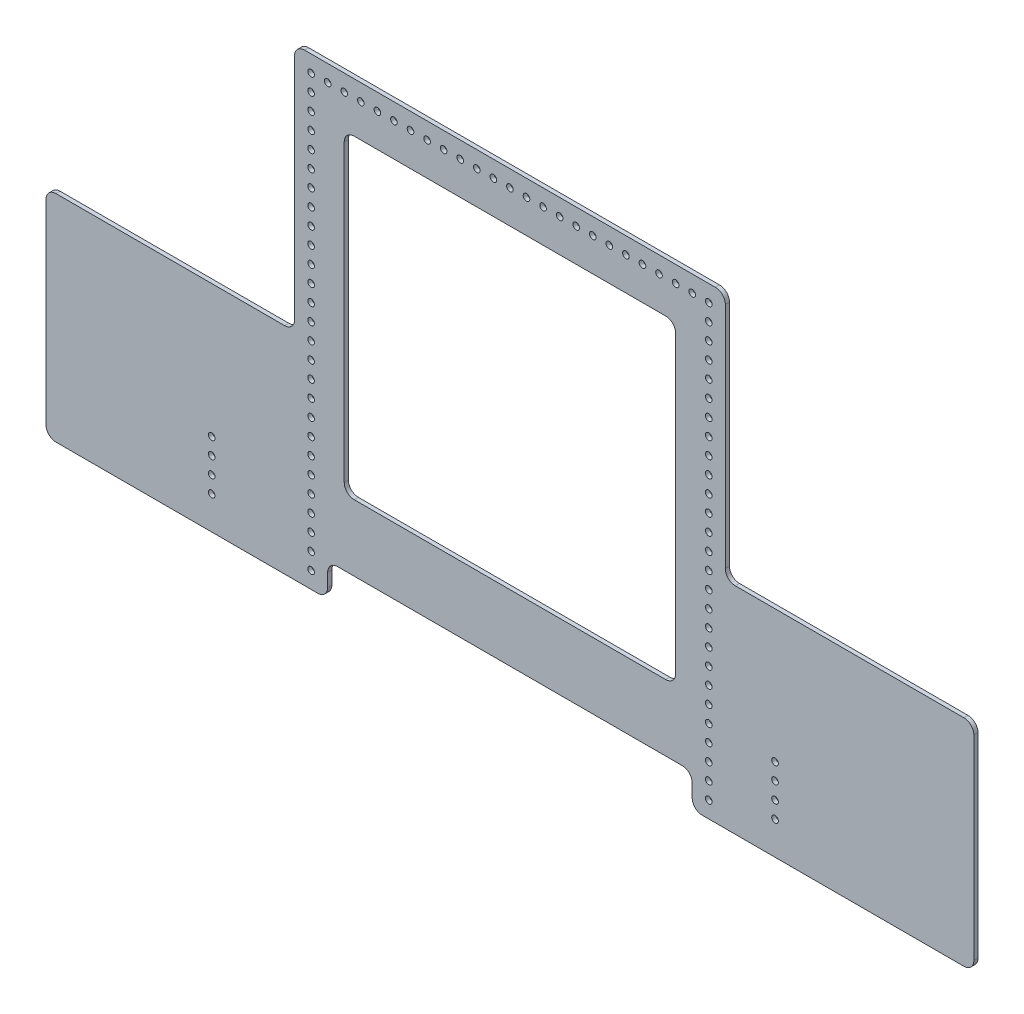
from build123d import *

# Parameters (mm, degrees)
SKETCH1_R           = 2.54
SKETCH1_W           = 254
SKETCH1_H           = 241.3
BOSS_EXTRUDE1_DEPTH = 3.175
FILLET1_R           = 7.62


with BuildPart() as part:
    # Sketch1 → Boss-Extrude1 (new body)
    with BuildSketch(Plane.XY):
        Polygon((392.015739824, -380.530659381), (607.915739824, -380.530659381), (607.915739824, -215.553323478), (417.415739824, -215.553323478), (417.415739824, -25.053323478), (87.215739824, -25.053323478), (87.215739824, -215.553323478), (-103.284260176, -215.553323478), (-103.284260176, -380.530659381), (112.615739824, -380.530659381), (112.615739824, -355.253323478), (392.015739824, -355.253323478), align=None)
        with Locations((99.915739824, -37.753323478)):
            Circle(SKETCH1_R, mode=Mode.SUBTRACT)
        with Locations((112.615739824, -37.753323478)):
            Circle(SKETCH1_R, mode=Mode.SUBTRACT)
        with Locations((125.315739824, -37.753323478)):
            Circle(SKETCH1_R, mode=Mode.SUBTRACT)
        with Locations((138.015739824, -37.753323478)):
            Circle(SKETCH1_R, mode=Mode.SUBTRACT)
        with Locations((150.715739824, -37.753323478)):
            Circle(SKETCH1_R, mode=Mode.SUBTRACT)
        with Locations((163.415739824, -37.753323478)):
            Circle(SKETCH1_R, mode=Mode.SUBTRACT)
        with Locations((176.115739824, -37.753323478)):
            Circle(SKETCH1_R, mode=Mode.SUBTRACT)
        with Locations((188.815739824, -37.753323478)):
            Circle(SKETCH1_R, mode=Mode.SUBTRACT)
        with Locations((201.515739824, -37.753323478)):
            Circle(SKETCH1_R, mode=Mode.SUBTRACT)
        with Locations((214.215739824, -37.753323478)):
            Circle(SKETCH1_R, mode=Mode.SUBTRACT)
        with Locations((226.915739824, -37.753323478)):
            Circle(SKETCH1_R, mode=Mode.SUBTRACT)
        with Locations((239.615739824, -37.753323478)):
            Circle(SKETCH1_R, mode=Mode.SUBTRACT)
        with Locations((252.315739824, -37.753323478)):
            Circle(SKETCH1_R, mode=Mode.SUBTRACT)
        with Locations((265.015739824, -37.753323478)):
            Circle(SKETCH1_R, mode=Mode.SUBTRACT)
        with Locations((277.715739824, -37.753323478)):
            Circle(SKETCH1_R, mode=Mode.SUBTRACT)
        with Locations((290.415739824, -37.753323478)):
            Circle(SKETCH1_R, mode=Mode.SUBTRACT)
        with Locations((303.115739824, -37.753323478)):
            Circle(SKETCH1_R, mode=Mode.SUBTRACT)
        with Locations((315.815739824, -37.753323478)):
            Circle(SKETCH1_R, mode=Mode.SUBTRACT)
        with Locations((328.515739824, -37.753323478)):
            Circle(SKETCH1_R, mode=Mode.SUBTRACT)
        with Locations((341.215739824, -37.753323478)):
            Circle(SKETCH1_R, mode=Mode.SUBTRACT)
        with Locations((353.915739824, -37.753323478)):
            Circle(SKETCH1_R, mode=Mode.SUBTRACT)
        with Locations((366.615739824, -37.753323478)):
            Circle(SKETCH1_R, mode=Mode.SUBTRACT)
        with Locations((379.315739824, -37.753323478)):
            Circle(SKETCH1_R, mode=Mode.SUBTRACT)
        with Locations((392.015739824, -37.753323478)):
            Circle(SKETCH1_R, mode=Mode.SUBTRACT)
        with Locations((404.715739824, -37.753323478)):
            Circle(SKETCH1_R, mode=Mode.SUBTRACT)
        with Locations((99.915739824, -50.453323478)):
            Circle(SKETCH1_R, mode=Mode.SUBTRACT)
        with Locations((99.915739824, -63.153323478)):
            Circle(SKETCH1_R, mode=Mode.SUBTRACT)
        with Locations((99.915739824, -75.853323478)):
            Circle(SKETCH1_R, mode=Mode.SUBTRACT)
        with Locations((99.915739824, -88.553323478)):
            Circle(SKETCH1_R, mode=Mode.SUBTRACT)
        with Locations((99.915739824, -101.253323478)):
            Circle(SKETCH1_R, mode=Mode.SUBTRACT)
        with Locations((99.915739824, -113.953323478)):
            Circle(SKETCH1_R, mode=Mode.SUBTRACT)
        with Locations((99.915739824, -126.653323478)):
            Circle(SKETCH1_R, mode=Mode.SUBTRACT)
        with Locations((99.915739824, -139.353323478)):
            Circle(SKETCH1_R, mode=Mode.SUBTRACT)
        with Locations((99.915739824, -152.053323478)):
            Circle(SKETCH1_R, mode=Mode.SUBTRACT)
        with Locations((99.915739824, -164.753323478)):
            Circle(SKETCH1_R, mode=Mode.SUBTRACT)
        with Locations((99.915739824, -177.453323478)):
            Circle(SKETCH1_R, mode=Mode.SUBTRACT)
        with Locations((99.915739824, -190.153323478)):
            Circle(SKETCH1_R, mode=Mode.SUBTRACT)
        with Locations((99.915739824, -202.853323478)):
            Circle(SKETCH1_R, mode=Mode.SUBTRACT)
        with Locations((99.915739824, -215.553323478)):
            Circle(SKETCH1_R, mode=Mode.SUBTRACT)
        with Locations((99.915739824, -228.253323478)):
            Circle(SKETCH1_R, mode=Mode.SUBTRACT)
        with Locations((99.915739824, -240.953323478)):
            Circle(SKETCH1_R, mode=Mode.SUBTRACT)
        with Locations((99.915739824, -253.653323478)):
            Circle(SKETCH1_R, mode=Mode.SUBTRACT)
        with Locations((99.915739824, -266.353323478)):
            Circle(SKETCH1_R, mode=Mode.SUBTRACT)
        with Locations((99.915739824, -279.053323478)):
            Circle(SKETCH1_R, mode=Mode.SUBTRACT)
        with Locations((99.915739824, -291.753323478)):
            Circle(SKETCH1_R, mode=Mode.SUBTRACT)
        with Locations((99.915739824, -304.453323478)):
            Circle(SKETCH1_R, mode=Mode.SUBTRACT)
        with Locations((99.915739824, -317.153323478)):
            Circle(SKETCH1_R, mode=Mode.SUBTRACT)
        with Locations((99.915739824, -329.853323478)):
            Circle(SKETCH1_R, mode=Mode.SUBTRACT)
        with Locations((99.915739824, -342.553323478)):
            Circle(SKETCH1_R, mode=Mode.SUBTRACT)
        with Locations((99.915739824, -355.253323478)):
            Circle(SKETCH1_R, mode=Mode.SUBTRACT)
        with Locations((99.915739824, -367.953323478)):
            Circle(SKETCH1_R, mode=Mode.SUBTRACT)
        with Locations((404.715739824, -50.453323478)):
            Circle(SKETCH1_R, mode=Mode.SUBTRACT)
        with Locations((404.715739824, -63.153323478)):
            Circle(SKETCH1_R, mode=Mode.SUBTRACT)
        with Locations((404.715739824, -75.853323478)):
            Circle(SKETCH1_R, mode=Mode.SUBTRACT)
        with Locations((404.715739824, -88.553323478)):
            Circle(SKETCH1_R, mode=Mode.SUBTRACT)
        with Locations((404.715739824, -101.253323478)):
            Circle(SKETCH1_R, mode=Mode.SUBTRACT)
        with Locations((404.715739824, -113.953323478)):
            Circle(SKETCH1_R, mode=Mode.SUBTRACT)
        with Locations((404.715739824, -126.653323478)):
            Circle(SKETCH1_R, mode=Mode.SUBTRACT)
        with Locations((404.715739824, -139.353323478)):
            Circle(SKETCH1_R, mode=Mode.SUBTRACT)
        with Locations((404.715739824, -152.053323478)):
            Circle(SKETCH1_R, mode=Mode.SUBTRACT)
        with Locations((404.715739824, -164.753323478)):
            Circle(SKETCH1_R, mode=Mode.SUBTRACT)
        with Locations((404.715739824, -177.453323478)):
            Circle(SKETCH1_R, mode=Mode.SUBTRACT)
        with Locations((404.715739824, -190.153323478)):
            Circle(SKETCH1_R, mode=Mode.SUBTRACT)
        with Locations((404.715739824, -202.853323478)):
            Circle(SKETCH1_R, mode=Mode.SUBTRACT)
        with Locations((404.715739824, -215.553323478)):
            Circle(SKETCH1_R, mode=Mode.SUBTRACT)
        with Locations((404.715739824, -228.253323478)):
            Circle(SKETCH1_R, mode=Mode.SUBTRACT)
        with Locations((404.715739824, -240.953323478)):
            Circle(SKETCH1_R, mode=Mode.SUBTRACT)
        with Locations((404.715739824, -253.653323478)):
            Circle(SKETCH1_R, mode=Mode.SUBTRACT)
        with Locations((404.715739824, -266.353323478)):
            Circle(SKETCH1_R, mode=Mode.SUBTRACT)
        with Locations((404.715739824, -279.053323478)):
            Circle(SKETCH1_R, mode=Mode.SUBTRACT)
        with Locations((404.715739824, -291.753323478)):
            Circle(SKETCH1_R, mode=Mode.SUBTRACT)
        with Locations((404.715739824, -304.453323478)):
            Circle(SKETCH1_R, mode=Mode.SUBTRACT)
        with Locations((404.715739824, -317.153323478)):
            Circle(SKETCH1_R, mode=Mode.SUBTRACT)
        with Locations((404.715739824, -329.853323478)):
            Circle(SKETCH1_R, mode=Mode.SUBTRACT)
        with Locations((404.715739824, -342.553323478)):
            Circle(SKETCH1_R, mode=Mode.SUBTRACT)
        with Locations((404.715739824, -355.253323478)):
            Circle(SKETCH1_R, mode=Mode.SUBTRACT)
        with Locations((404.715739824, -367.953323478)):
            Circle(SKETCH1_R, mode=Mode.SUBTRACT)
        with Locations((23.715739824, -317.153323478)):
            Circle(SKETCH1_R, mode=Mode.SUBTRACT)
        with Locations((455.515739824, -317.153323478)):
            Circle(SKETCH1_R, mode=Mode.SUBTRACT)
        with Locations((455.515739824, -329.853323478)):
            Circle(SKETCH1_R, mode=Mode.SUBTRACT)
        with Locations((455.515739824, -342.553323478)):
            Circle(SKETCH1_R, mode=Mode.SUBTRACT)
        with Locations((455.515739824, -355.253323478)):
            Circle(SKETCH1_R, mode=Mode.SUBTRACT)
        with Locations((23.715739824, -329.853323478)):
            Circle(SKETCH1_R, mode=Mode.SUBTRACT)
        with Locations((23.715739824, -342.553323478)):
            Circle(SKETCH1_R, mode=Mode.SUBTRACT)
        with Locations((23.715739824, -355.253323478)):
            Circle(SKETCH1_R, mode=Mode.SUBTRACT)
        with Locations((252.315739824, -183.803323478)):
            Rectangle(SKETCH1_W, SKETCH1_H, mode=Mode.SUBTRACT)
    extrude(amount=BOSS_EXTRUDE1_DEPTH)

    # Fillet1
    fillet1_edges = [part.edges().sort_by_distance(p)[0] for p in [
        (607.915739824, -380.530659381, 1.5875),
        (392.015739824, -380.530659381, 1.5875),
        (392.015739824, -355.253323478, 1.5875),
        (112.615739824, -355.253323478, 1.5875),
        (112.615739824, -380.530659381, 1.5875),
        (-103.284260176, -380.530659381, 1.5875),
        (-103.284260176, -215.553323478, 1.5875),
        (87.215739824, -215.553323478, 1.5875),
        (87.215739824, -25.053323478, 1.5875),
        (417.415739824, -25.053323478, 1.5875),
        (417.415739824, -215.553323478, 1.5875),
        (607.915739824, -215.553323478, 1.5875),
        (125.315739824, -63.153323478, 1.5875),
        (125.315739824, -304.453323478, 1.5875),
        (379.315739824, -304.453323478, 1.5875),
        (379.315739824, -63.153323478, 1.5875),
    ]]
    fillet(fillet1_edges, radius=FILLET1_R)


solid = part.part
